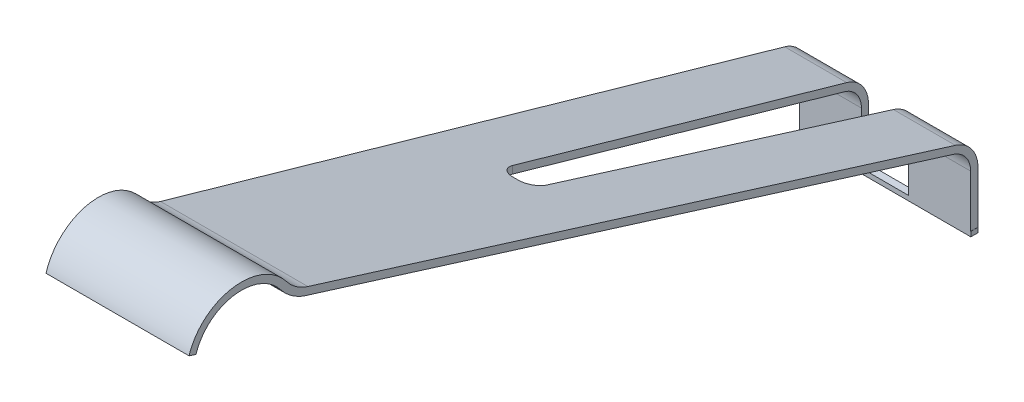
from build123d import *

# Parameters (mm, degrees)
HOOK_LEVER_DEPTH      = 1.8
HOOK_LEVER_DEPTH_BACK = 1.8
CUT_DEPTH             = 14.210060999


with BuildPart() as part:
    # Эскиз1 → Hook_Lever (new, two sides: drawn at the far end of the back side and taken through both)
    with BuildSketch(Plane(origin=(2.85, 0, 0), x_dir=(0, 0, -1), z_dir=(1, 0, 0)).offset(-HOOK_LEVER_DEPTH_BACK)):
        with BuildLine():
            Line((5.55, 4.85), (5.55, 6.042820323))
            ThreePointArc((5.55, 6.042820323), (5.450943953, 6.341557576), (5.193024215, 6.521927904))
            Line((5.193024215, 6.521927904), (-8.144994918, 10.50362176))
            ThreePointArc((-8.144994918, 10.50362176), (-8.427699037, 10.639328236), (-8.654473244, 10.855918461))
            ThreePointArc((-8.654473244, 10.855918461), (-9.625040353, 11.23456126), (-10.40562376, 10.544589936))
            Line((-10.40562376, 10.544589936), (-10.548967324, 10.588778426))
            ThreePointArc((-10.548967324, 10.588778426), (-9.651296406, 11.382245449), (-8.535144231, 10.94680623))
            ThreePointArc((-8.535144231, 10.94680623), (-8.342386155, 10.762704538), (-8.102087654, 10.647354034))
            Line((-8.102087654, 10.647354034), (5.235931479, 6.665660178))
            ThreePointArc((5.235931479, 6.665660178), (5.571227139, 6.431178752), (5.7, 6.042820323))
            Line((5.7, 6.042820323), (5.7, 4.85))
            Line((5.7, 4.85), (5.55, 4.85))
        make_face()
    extrude(amount=HOOK_LEVER_DEPTH + HOOK_LEVER_DEPTH_BACK)

    # Эскиз2 → Cut (cut, through all)
    with BuildSketch(Plane(origin=(0, 4.95, 0), x_dir=(1, 0, 0), z_dir=(0, 1, 0))):
        Polygon((1.05, 5.8), (1.35, -10.548967324), (1.05, -10.548967324), align=None)
        Polygon((4.65, 5.8), (4.65, -10.548967324), (4.35, -10.548967324), align=None)
        with BuildLine():
            Line((2.35, 5.8), (3.35, 5.8))
            Line((3.35, 5.8), (3.20551955, -1.905624011))
            ThreePointArc((3.20551955, -1.905624011), (3.115706509, -2.11411119), (2.90557227, -2.2))
            Line((2.90557227, -2.2), (2.79442773, -2.2))
            ThreePointArc((2.79442773, -2.2), (2.584293491, -2.11411119), (2.49448045, -1.905624011))
            Line((2.49448045, -1.905624011), (2.35, 5.8))
        make_face()
    extrude(amount=CUT_DEPTH, mode=Mode.SUBTRACT)


solid = part.part
